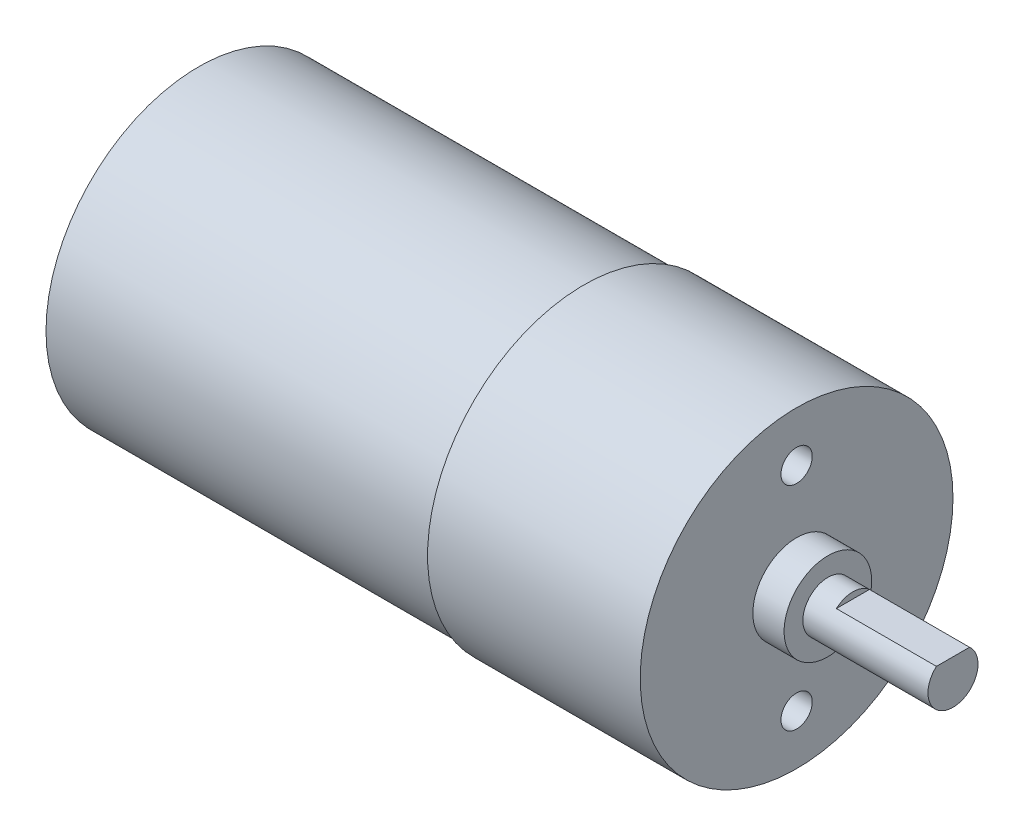
from build123d import *

# Parameters (mm, degrees)
SKETCH2_R               = 12.5
BOSS_EXTRUDE1_DEPTH     = 17
SKETCH3_R               = 12.2
BOSS_EXTRUDE2_DEPTH     = 30.8
SKETCH4_R               = 3.5
BOSS_EXTRUDE3_DEPTH     = 2.5
SKETCH5_R               = 2
BOSS_EXTRUDE4_DEPTH     = 10
CUT_EXTRUDE1_DEPTH      = 63.837807091
CUT_EXTRUDE1_DEPTH_BACK = 8
M3_TAPPED_HOLE1_D       = 2.5
M3_TAPPED_HOLE1_DEPTH   = 4.55
M3_TAPPED_HOLE1_TIP     = 0.751075774


with BuildPart() as part:
    # Sketch2 → Boss-Extrude1 (new body)
    with BuildSketch(Plane(origin=(0, 0, 0), x_dir=(0, 0, -1), z_dir=(1, 0, 0))):
        Circle(SKETCH2_R)
    extrude(amount=-BOSS_EXTRUDE1_DEPTH)

    # Sketch3 → Boss-Extrude2 (add)
    with BuildSketch(Plane.ZY.offset(17)):
        with Locations(Location((0, 0, 0), (0, 0, 180))):
            Circle(SKETCH3_R)
    extrude(amount=BOSS_EXTRUDE2_DEPTH)

    # Sketch4 → Boss-Extrude3 (add)
    with BuildSketch(Plane(origin=(0, 0, 0), x_dir=(0, 0, -1), z_dir=(1, 0, 0))):
        Circle(SKETCH4_R)
    extrude(amount=BOSS_EXTRUDE3_DEPTH)

    # Sketch5 → Boss-Extrude4 (add)
    with BuildSketch(Plane(origin=(2.5, 0, 0), x_dir=(0, 0, -1), z_dir=(1, 0, 0))):
        Circle(SKETCH5_R)
    extrude(amount=BOSS_EXTRUDE4_DEPTH)

    # Sketch6 → Cut-Extrude1 (cut, two sides: drawn at the far end of the back side and taken through both)
    with BuildSketch(Plane(origin=(12.5, 0, 0), x_dir=(0, 0, -1), z_dir=(1, 0, 0)).offset(-CUT_EXTRUDE1_DEPTH_BACK)):
        Polygon((-50.671161076, 1.5), (-1.322875656, 1.5), (1.322875656, 1.5), (50.671161076, 1.5), (50.671161076, 100.196570842), (-50.671161076, 100.196570842), align=None)
    extrude(amount=CUT_EXTRUDE1_DEPTH + CUT_EXTRUDE1_DEPTH_BACK, mode=Mode.SUBTRACT)

    # M3 Tapped Hole1
    with Locations(Plane(origin=(0, 0, 0), x_dir=(0, 0, -1), z_dir=(1, 0, 0))):
        with Locations((0, 8.5), (0, -8.5)):
            Hole(M3_TAPPED_HOLE1_D / 2, depth=M3_TAPPED_HOLE1_DEPTH)
            with Locations((0, 0, -(M3_TAPPED_HOLE1_DEPTH + M3_TAPPED_HOLE1_TIP / 2))):  # 118° drill point
                Cone(0, M3_TAPPED_HOLE1_D / 2, M3_TAPPED_HOLE1_TIP, mode=Mode.SUBTRACT)


solid = part.part
